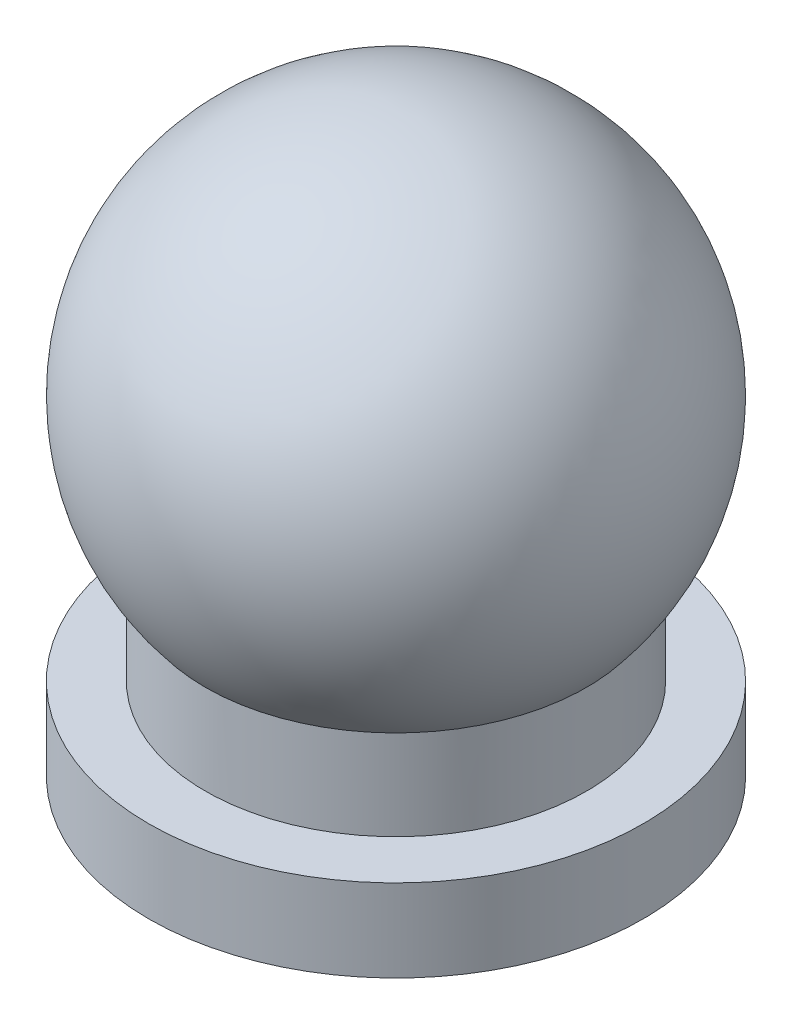
from build123d import *

# Parameters (mm, degrees)
SKETCH1_R           = 3
BOSS_EXTRUDE1_DEPTH = 1
SKETCH4_R           = 0.975
CUT_EXTRUDE1_DEPTH  = 5.5


with BuildPart() as part:
    # Sketch1 → Boss-Extrude1 (new body)
    with BuildSketch(Plane(origin=(0, 0, 0), x_dir=(1, 0, 0), z_dir=(0, 1, 0))):
        with Locations(Location((0, 0, 0), (0, 0, 270))):
            Circle(SKETCH1_R)
    extrude(amount=BOSS_EXTRUDE1_DEPTH)

    # Sketch3 → Revolve2 (revolve)
    with BuildSketch(Plane(origin=(0, 0, 0), x_dir=(0, 0, -1), z_dir=(1, 0, 0))):
        with BuildLine():
            Line((-1.156919819, 1), (0, 1))
            Line((0, 1), (0, 4))
            Line((0, 4), (0, 7))
            ThreePointArc((0, 7), (-2.121320344, 6.121320344), (-3, 4))
            ThreePointArc((-3, 4), (-2.823253346, 2.98548507), (-2.313839638, 2.090511553))
            Line((-2.313839638, 2.090511553), (-2.313839638, 1))
            Line((-2.313839638, 1), (-1.156919819, 1))
        make_face()
    revolve(axis=Axis((0, 4, 0), (0, 1, 0)))

    # Sketch4 → Cut-Extrude1 (cut)
    with BuildSketch(Plane.XZ):
        with Locations(Location((0, 0, 0), (0, 0, 270))):
            Circle(SKETCH4_R)
    extrude(amount=-CUT_EXTRUDE1_DEPTH, mode=Mode.SUBTRACT)


solid = part.part
